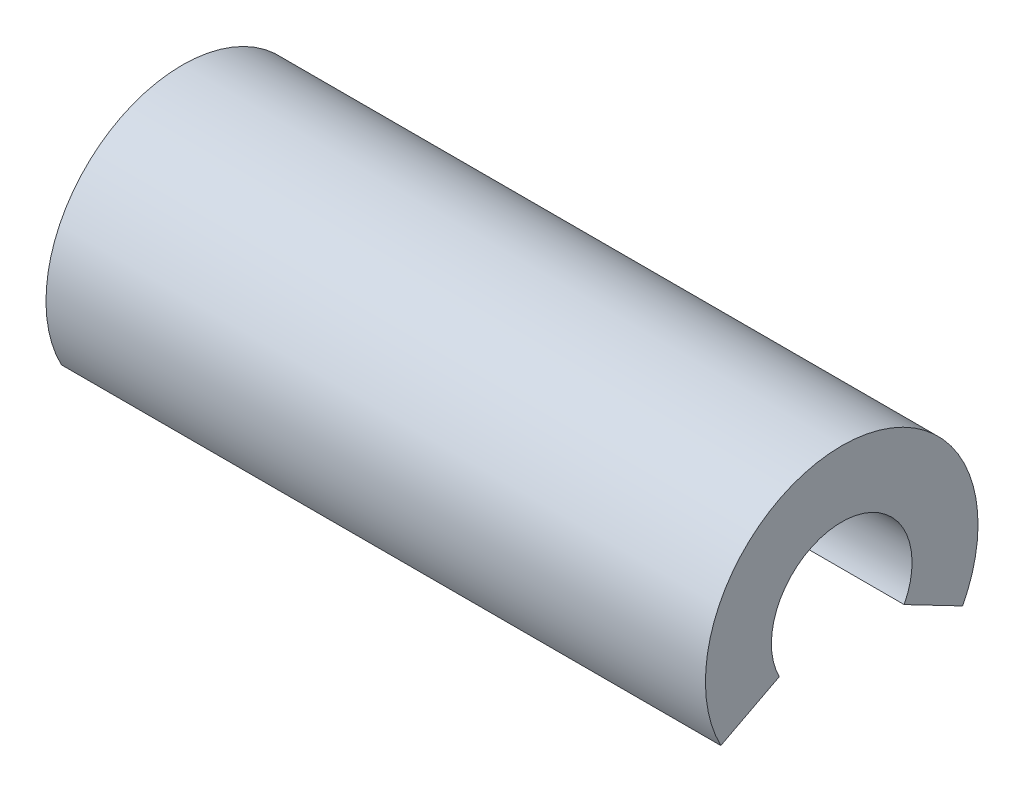
from build123d import *

# Parameters (mm, degrees)
BOSS_EXTRUDE1_DEPTH = 30


with BuildPart() as part:
    # Sketch1 → Boss-Extrude1 (new body)
    with BuildSketch(Plane(origin=(0, 0, 0), x_dir=(0, 0, -1), z_dir=(1, 0, 0))):
        with BuildLine():
            Line((-5.5, -2.861817604), (-2.838709677, -1.477067151))
            ThreePointArc((-2.838709677, -1.477067151), (0, 3.2), (2.838709677, -1.477067151))
            Line((2.838709677, -1.477067151), (5.5, -2.861817604))
            ThreePointArc((5.5, -2.861817604), (0, 6.2), (-5.5, -2.861817604))
        make_face()
    extrude(amount=BOSS_EXTRUDE1_DEPTH)


solid = part.part
